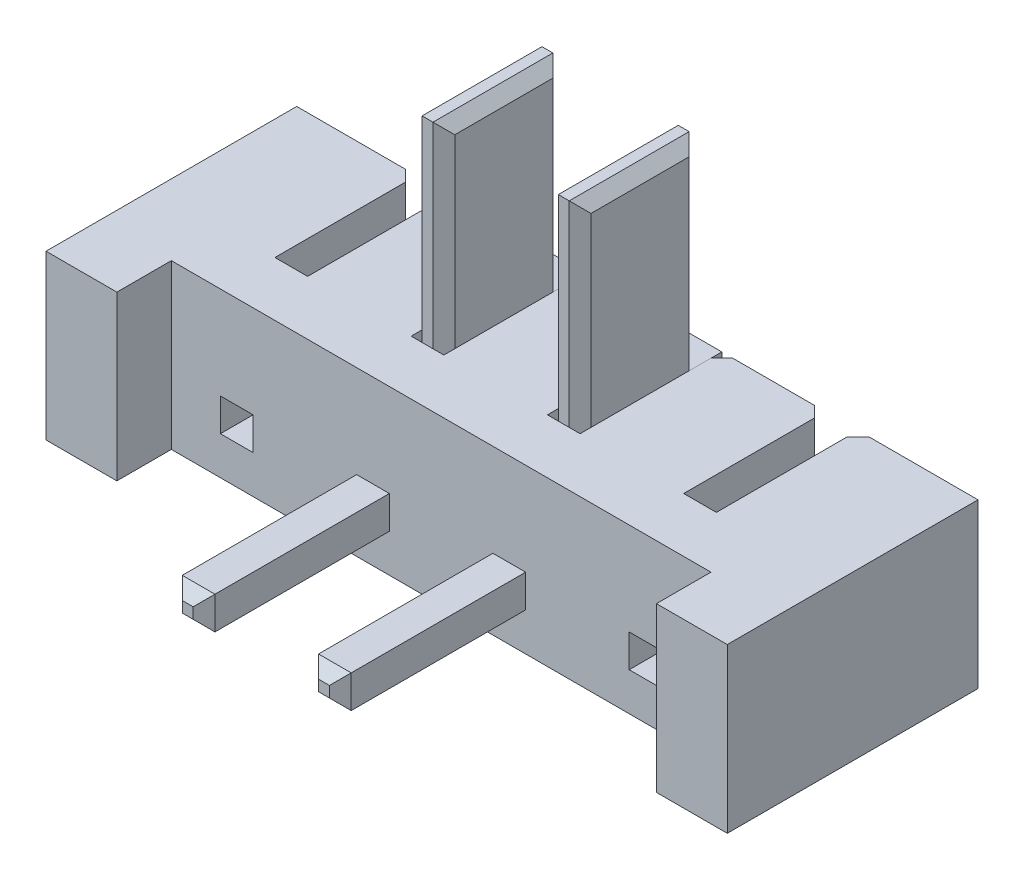
from build123d import *

# Parameters (mm, degrees)
SKETCH_1_W          = 12.5
SKETCH_1_H          = 3
EXTRUDE_1_DEPTH     = 4.6
SKETCH_2_W          = 9.9
SKETCH_2_H          = 3
CUT_EXTRUDE_1_DEPTH = 1
SKETCH_3_W          = 0.6
SKETCH_3_H          = 2.6
CUT_EXTRUDE_2_DEPTH = 2.3
CHAMFER_1_SIZE      = 0.2
SKETCH_5_W          = 0.6
SKETCH_5_H          = 0.6
CUT_EXTRUDE_3_DEPTH = 14.115258289
SKETCH_6_W          = 0.6
SKETCH_6_H          = 2.2
EXTRUDE_2_DEPTH     = 5.9
SKETCH_9_W          = 0.6
SKETCH_9_H          = 2.3
EXTRUDE_8_DEPTH     = 0.4
SKETCH_8_W          = 0.6
SKETCH_8_H          = 0.6
EXTRUDE_7_DEPTH     = 4.4
CHAMFER_2_SIZE      = 0.2


with BuildPart() as part:
    # Эскиз1 → Бобышка-Вытянуть1 (new body)
    with BuildSketch(Plane.XY):
        with Locations((6.25, 1.5)):
            Rectangle(SKETCH_1_W, SKETCH_1_H)
    extrude(amount=EXTRUDE_1_DEPTH)

    # Эскиз2 → Вырез-Вытянуть1 (cut)
    with BuildSketch(Plane.XY.offset(4.6)):
        with Locations((6.25, 1.5)):
            Rectangle(SKETCH_2_W, SKETCH_2_H)
    extrude(amount=-CUT_EXTRUDE_1_DEPTH, mode=Mode.SUBTRACT)

    # Эскиз3 → Вырез-Вытянуть2 (cut)
    with BuildSketch(Plane(origin=(0, 3, 0), x_dir=(1, 0, 0), z_dir=(0, 1, 0))):
        with Locations((2.5, -1.3)):
            Rectangle(SKETCH_3_W, SKETCH_3_H)
        with Locations((5, -1.3)):
            Rectangle(SKETCH_3_W, SKETCH_3_H)
        with Locations((7.5, -1.3)):
            Rectangle(SKETCH_3_W, SKETCH_3_H)
        with Locations((10, -1.3)):
            Rectangle(SKETCH_3_W, SKETCH_3_H)
    extrude(amount=-CUT_EXTRUDE_2_DEPTH, mode=Mode.SUBTRACT)

    # Фаска1
    chamfer_1_edges = [part.edges().sort_by_distance(p)[0] for p in [
        (2.8, 1.85, 0),
        (2.2, 1.85, 0),
        (5.3, 1.85, 0),
        (4.7, 1.85, 0),
        (7.8, 1.85, 0),
        (7.2, 1.85, 0),
        (10.3, 1.85, 0),
        (9.7, 1.85, 0),
    ]]
    chamfer(chamfer_1_edges, length=CHAMFER_1_SIZE)

    # Эскиз5 → Вырез-Вытянуть3 (cut, through all)
    with BuildSketch(Plane(origin=(0, 0, 2.6), x_dir=(-1, 0, 0), z_dir=(0, 0, -1))):
        with Locations((-10, 1)):
            Rectangle(SKETCH_5_W, SKETCH_5_H)
        with Locations((-7.5, 1)):
            Rectangle(SKETCH_5_W, SKETCH_5_H)
        with Locations((-5, 1)):
            Rectangle(SKETCH_5_W, SKETCH_5_H)
        with Locations((-2.5, 1)):
            Rectangle(SKETCH_5_W, SKETCH_5_H)
    extrude(amount=-CUT_EXTRUDE_3_DEPTH, mode=Mode.SUBTRACT)


with BuildPart() as body_2:
    # Эскиз6 → Бобышка-Вытянуть2 (new body)
    with BuildSketch(Plane(origin=(0, 6.6, 0), x_dir=(1, 0, 0), z_dir=(0, 1, 0))):
        with Locations((5, -1.5)):
            Rectangle(SKETCH_6_W, SKETCH_6_H)
    extrude(amount=-EXTRUDE_2_DEPTH)

    # Эскиз9 → Бобышка-Вытянуть8 (add)
    with BuildSketch(Plane(origin=(0, 0, 0.4), x_dir=(-1, 0, 0), z_dir=(0, 0, -1))):
        with Locations((-5, 1.85)):
            Rectangle(SKETCH_9_W, SKETCH_9_H)
    extrude(amount=EXTRUDE_8_DEPTH)

    # Эскиз8 → Бобышка-Вытянуть7 (add)
    with BuildSketch(Plane.XY.offset(2.6)):
        with Locations((5, 1)):
            Rectangle(SKETCH_8_W, SKETCH_8_H)
    extrude(amount=EXTRUDE_7_DEPTH)

    # Фаска2
    chamfer_2_edges = [body_2.edges().sort_by_distance(p)[0] for p in [
        (4.7, 3.95, 2.6),
        (4.7, 4.8, 0.4),
        (4.7, 6.6, 1.5),
        (5.3, 3.95, 2.6),
        (5.3, 6.6, 1.5),
        (5.3, 4.8, 0.4),
        (4.7, 1, 7),
        (5.3, 1, 7),
        (5, 1.3, 7),
        (5, 0.7, 7),
    ]]
    chamfer(chamfer_2_edges, length=CHAMFER_2_SIZE)


with BuildPart() as body_3:
    # Зеркальное отражение1: mirrored copy
    add(body_2.part.mirror(Plane(origin=(6.25, 0, 0), x_dir=(0, 0, 1), z_dir=(1, 0, 0))))


solid = Compound([part.part, body_2.part, body_3.part])
